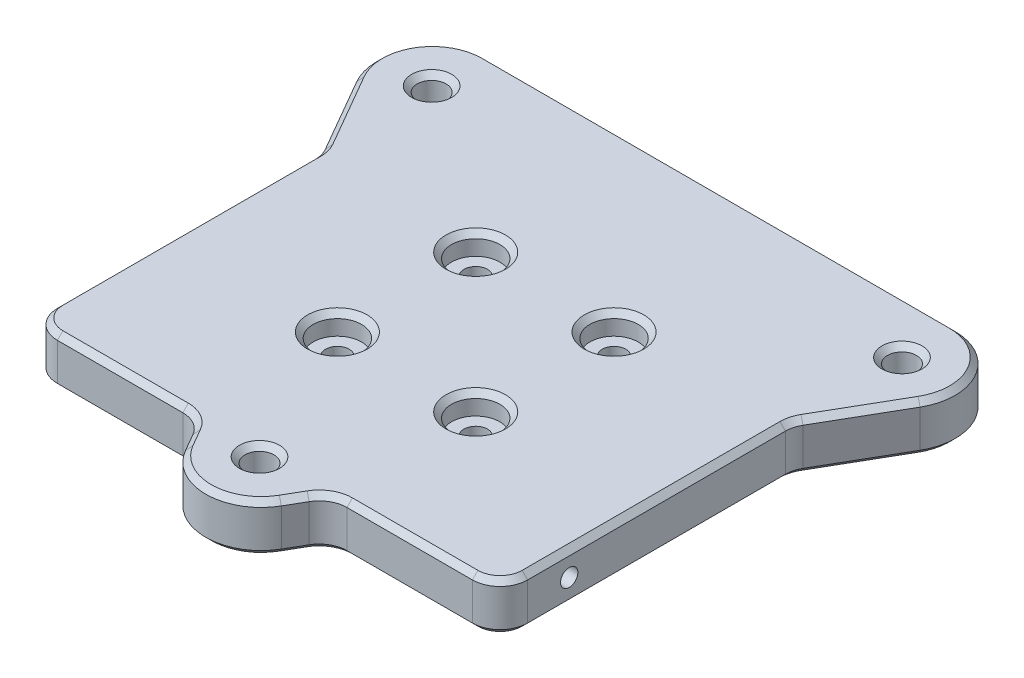
from build123d import *

# Parameters (mm, degrees)
BOSS_EXTRUDE1_DEPTH                 = 7
SKETCH3_W                           = 68
SKETCH3_H                           = 66
BOSS_EXTRUDE2_DEPTH                 = 7
SKETCH5_R                           = 1
HOLE_POSITIONS_DEPTH                = 74.137994469
M5X0_8_TAPPED_HOLE1_D               = 4.2
CBORE_FOR_M3_SHCS1_D                = 3.4
CBORE_FOR_M3_SHCS1_CBORE_D          = 7
CBORE_FOR_M3_SHCS1_CBORE_DEPTH      = 3
FILLET1_R                           = 8
FILLET2_R                           = 4
M3X0_5_TAPPED_HOLE1_D               = 2.5
M3X0_5_TAPPED_HOLE1_DEPTH           = 7.5
M3X0_5_TAPPED_HOLE1_TIP             = 0.751075774
M3X0_5_TAPPED_HOLE1_ON_FACE_2_D     = 2.5
M3X0_5_TAPPED_HOLE1_ON_FACE_2_DEPTH = 7.5
M3X0_5_TAPPED_HOLE1_ON_FACE_2_TIP   = 0.751075774
M3X0_5_TAPPED_HOLE1_ON_FACE_3_D     = 2.5
M3X0_5_TAPPED_HOLE1_ON_FACE_3_DEPTH = 7.5
M3X0_5_TAPPED_HOLE1_ON_FACE_3_TIP   = 0.751075774
CHAMFER1_SIZE                       = 0.8


with BuildPart() as part:
    # Sketch1 → Boss-Extrude1 (new body)
    with BuildSketch(Plane(origin=(0, 0, 0), x_dir=(1, 0, 0), z_dir=(0, 1, 0))):
        Polygon((0, -55.033320997), (47.660254038, 27.516660498), (-47.660254038, 27.516660498), align=None)
    extrude(amount=BOSS_EXTRUDE1_DEPTH)

    # Sketch3 → Boss-Extrude2 (add)
    with BuildSketch(Plane(origin=(0, 0, 0), x_dir=(1, 0, 0), z_dir=(0, 1, 0))):
        with Locations((0, -5.483339502)):
            Rectangle(SKETCH3_W, SKETCH3_H)
    extrude(amount=BOSS_EXTRUDE2_DEPTH)

    # Sketch5 → Hole Positions (cut, through all)
    with BuildSketch(Plane(origin=(0, 7, 0), x_dir=(1, 0, 0), z_dir=(0, 1, 0))):
        with Locations(Location((-34, 19.629909152, 0), (0, 0, 270))):
            Circle(SKETCH5_R)
        with Locations(Location((34, 19.629909152, 0), (0, 0, 270))):
            Circle(SKETCH5_R)
        with Locations(Location((0, -39.259818305, 0), (0, 0, 270))):
            Circle(SKETCH5_R)
    extrude(amount=-HOLE_POSITIONS_DEPTH, mode=Mode.SUBTRACT)

    # M5x0.8 Tapped Hole1 (through all)
    with Locations(Plane(origin=(0, 7, 0), x_dir=(1, 0, 0), z_dir=(0, 1, 0))):
        with Locations((-34, 19.629909152), (34, 19.629909152), (0, -39.259818305)):
            Hole(M5X0_8_TAPPED_HOLE1_D / 2)

    # CBORE for M3 SHCS1 (through all)
    with Locations(Plane(origin=(0, 7, 0), x_dir=(1, 0, 0), z_dir=(0, 1, 0))):
        with Locations((-10, 2), (10, 2), (10, -18), (-10, -18)):
            CounterBoreHole(CBORE_FOR_M3_SHCS1_D / 2, CBORE_FOR_M3_SHCS1_CBORE_D / 2, CBORE_FOR_M3_SHCS1_CBORE_DEPTH)

    # Fillet1
    fillet1_edges = [part.edges().sort_by_distance(p)[0] for p in [
        (-47.660254038, 3.5, -27.516660498),
        (47.660254038, 3.5, -27.516660498),
        (0, 3.5, 55.033320997),
    ]]
    fillet(fillet1_edges, radius=FILLET1_R)

    # Fillet2
    fillet2_edges = [part.edges().sort_by_distance(p)[0] for p in [
        (34, 3.5, -3.856406461),
        (34, 3.5, 38.483339502),
        (-34, 3.5, -3.856406461),
        (-9.555136271, 3.5, 38.483339502),
        (-34, 3.5, 38.483339502),
        (9.555136271, 3.5, 38.483339502),
    ]]
    fillet(fillet2_edges, radius=FILLET2_R)

    # M3x0.5 Tapped Hole1
    with Locations(Plane(origin=(-34, 3.5, 28.483339502), x_dir=(0, 0, -1), z_dir=(-1, 0, 0))):
        with Locations((0, 0)):
            Hole(M3X0_5_TAPPED_HOLE1_D / 2, depth=M3X0_5_TAPPED_HOLE1_DEPTH)
            with Locations((0, 0, -(M3X0_5_TAPPED_HOLE1_DEPTH + M3X0_5_TAPPED_HOLE1_TIP / 2))):  # 118° drill point
                Cone(0, M3X0_5_TAPPED_HOLE1_D / 2, M3X0_5_TAPPED_HOLE1_TIP, mode=Mode.SUBTRACT)

    # M3x0.5 Tapped Hole1 on face 2
    with Locations(Plane(origin=(34, 3.5, 28.483339502), x_dir=(0, 0, 1), z_dir=(1, 0, 0))):
        with Locations((0, 0)):
            Hole(M3X0_5_TAPPED_HOLE1_ON_FACE_2_D / 2, depth=M3X0_5_TAPPED_HOLE1_ON_FACE_2_DEPTH)
            with Locations((0, 0, -(M3X0_5_TAPPED_HOLE1_ON_FACE_2_DEPTH + M3X0_5_TAPPED_HOLE1_ON_FACE_2_TIP / 2))):  # 118° drill point
                Cone(0, M3X0_5_TAPPED_HOLE1_ON_FACE_2_D / 2, M3X0_5_TAPPED_HOLE1_ON_FACE_2_TIP, mode=Mode.SUBTRACT)

    # M3x0.5 Tapped Hole1 on face 3
    with Locations(Plane(origin=(0, 3.5, -27.516660498), x_dir=(-1, 0, 0), z_dir=(0, 0, -1))):
        with Locations((0, 0)):
            Hole(M3X0_5_TAPPED_HOLE1_ON_FACE_3_D / 2, depth=M3X0_5_TAPPED_HOLE1_ON_FACE_3_DEPTH)
            with Locations((0, 0, -(M3X0_5_TAPPED_HOLE1_ON_FACE_3_DEPTH + M3X0_5_TAPPED_HOLE1_ON_FACE_3_TIP / 2))):  # 118° drill point
                Cone(0, M3X0_5_TAPPED_HOLE1_ON_FACE_3_D / 2, M3X0_5_TAPPED_HOLE1_ON_FACE_3_TIP, mode=Mode.SUBTRACT)

    # Chamfer1
    chamfer1_edges = [part.edges().sort_by_distance(p)[0] for p in [
        (-13.5, 7, -2),
        (-8.3, 0, -2),
        (0, 7, -27.516660498),
        (0, 0, -27.516660498),
        (-37.633974596, 0, -10.150635095),
        (7.664319482, 0, 41.758330249),
        (0, 0, 47.033320997),
        (-40.732050808, 0, -23.516660498),
        (40.732050808, 0, -23.516660498),
        (7.664319482, 7, 41.758330249),
        (-37.633974596, 7, -10.150635095),
        (0, 7, 47.033320997),
        (-40.732050808, 7, -23.516660498),
        (40.732050808, 7, -23.516660498),
        (-34, 7, 15.849364905),
        (-34, 0, 15.849364905),
        (-20.932268674, 0, 38.483339502),
        (-20.932268674, 7, 38.483339502),
        (37.633974596, 0, -10.150635095),
        (34, 0, 15.849364905),
        (20.932268674, 0, 38.483339502),
        (-7.664319482, 0, 41.758330249),
        (32.828427125, 0, 37.311766626),
        (-32.828427125, 0, 37.311766626),
        (37.633974596, 7, -10.150635095),
        (-7.664319482, 7, 41.758330249),
        (20.932268674, 7, 38.483339502),
        (34, 7, 15.849364905),
        (32.828427125, 7, 37.311766626),
        (-32.828427125, 7, 37.311766626),
        (-34.136296695, 0, -3.819885871),
        (-34.136296695, 7, -3.819885871),
        (-9.864537348, 7, 39.019237886),
        (-9.864537348, 0, 39.019237886),
        (9.864537348, 0, 39.019237886),
        (9.864537348, 7, 39.019237886),
        (34.136296695, 7, -3.819885871),
        (34.136296695, 0, -3.819885871),
        (2.1, 7, 39.259818305),
        (2.1, 0, 39.259818305),
        (36.1, 7, -19.629909152),
        (36.1, 0, -19.629909152),
        (-31.9, 7, -19.629909152),
        (-31.9, 0, -19.629909152),
        (-13.5, 7, 18),
        (-8.3, 0, 18),
        (6.5, 7, 18),
        (11.7, 0, 18),
        (6.5, 7, -2),
        (11.7, 0, -2),
    ]]
    chamfer(chamfer1_edges, length=CHAMFER1_SIZE)


solid = part.part
